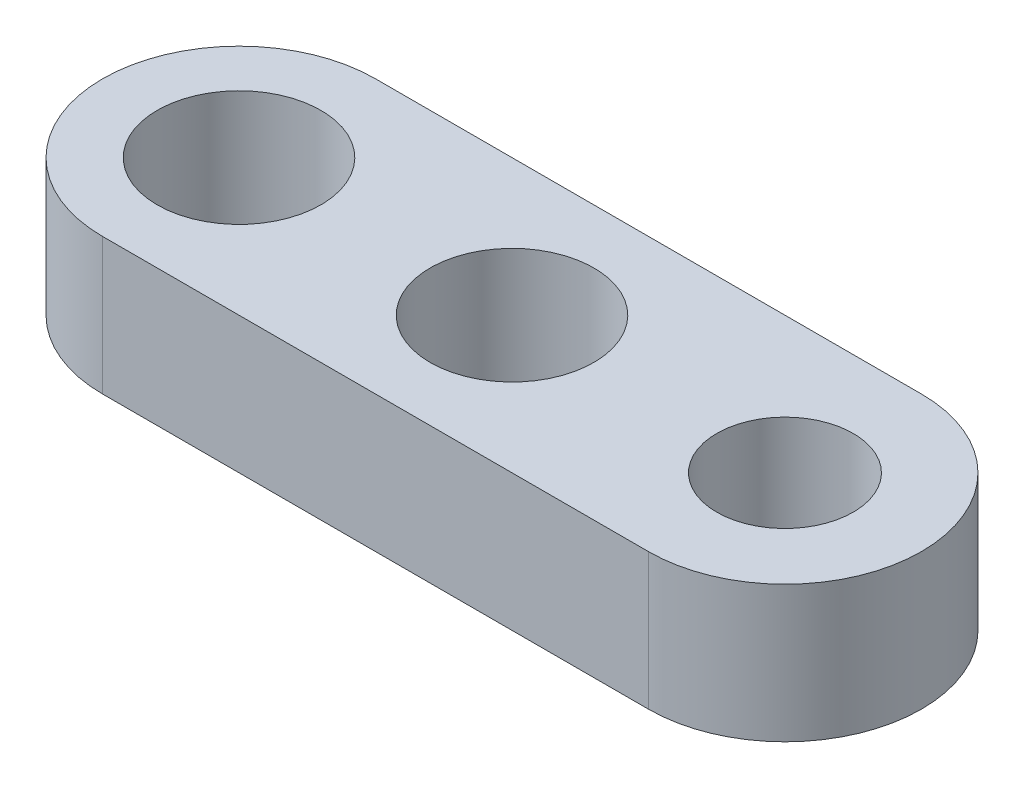
from build123d import *

# Parameters (mm, degrees)
SKETCH1_R           = 2.5
SKETCH1_R_2         = 3
BOSS_EXTRUDE1_DEPTH = 5


with BuildPart() as part:
    # Sketch1 → Boss-Extrude1 (new body)
    with BuildSketch(Plane(origin=(0, 0, 0), x_dir=(1, 0, 0), z_dir=(0, 1, 0))):
        with BuildLine():
            Line((0, -5), (-20, -5))
            ThreePointArc((-20, -5), (-25, 0), (-20, 5))
            Line((-20, 5), (0, 5))
            ThreePointArc((0, 5), (5, 0), (0, -5))
        make_face()
        with Locations(Location((0, 0, 0), (0, 0, 270))):
            Circle(SKETCH1_R, mode=Mode.SUBTRACT)
        with Locations(Location((-20, 0, 0), (0, 0, 270))):
            Circle(SKETCH1_R_2, mode=Mode.SUBTRACT)
        with Locations(Location((-10, 0, 0), (0, 0, 270))):
            Circle(SKETCH1_R_2, mode=Mode.SUBTRACT)
    extrude(amount=BOSS_EXTRUDE1_DEPTH)


solid = part.part
